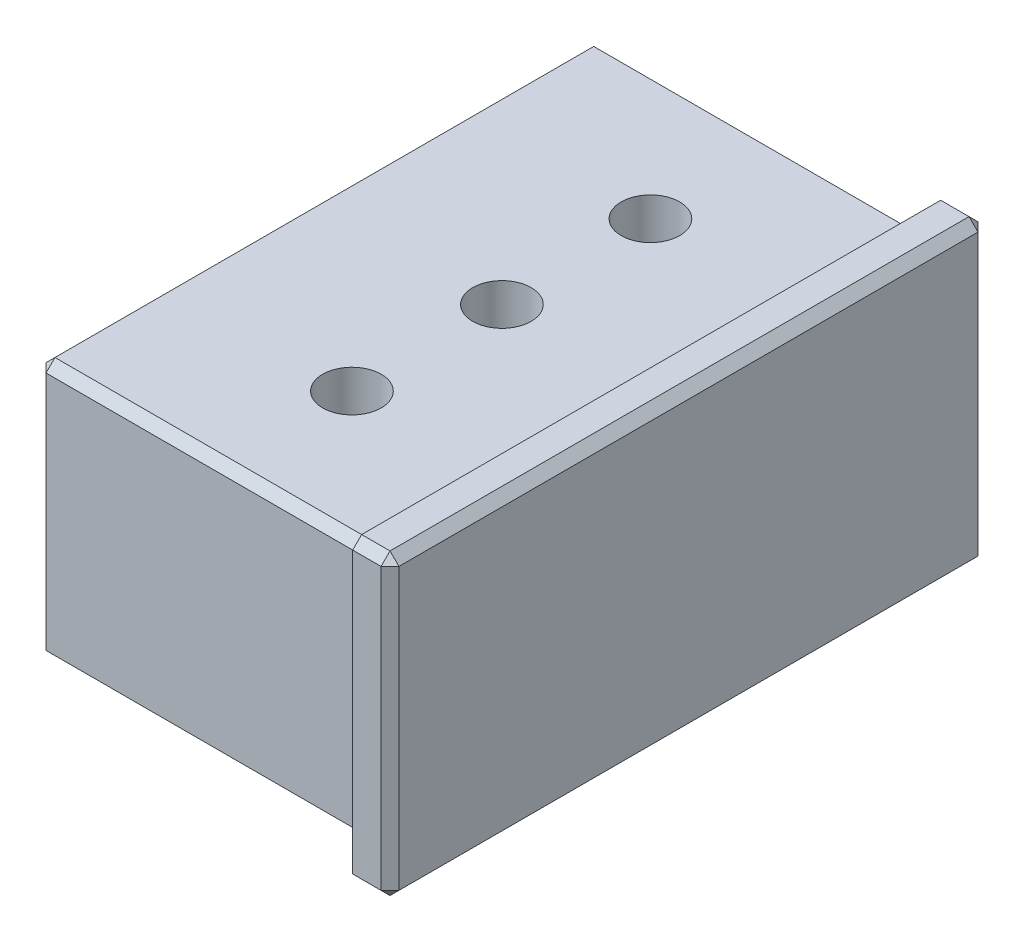
from build123d import *

# Parameters (mm, degrees)
SKETCH1_W           = 47.371
SKETCH1_H           = 21.971
BOSS_EXTRUDE1_DEPTH = 28.575
SKETCH2_W           = 50.8
SKETCH2_H           = 25.4
BOSS_EXTRUDE2_DEPTH = 3.175
CHAMFER1_SIZE       = 0.762
SKETCH3_R           = 2.4892
CUT_EXTRUDE1_DEPTH  = 64.074969049


with BuildPart() as part:
    # Sketch1 → Boss-Extrude1 (new body)
    with BuildSketch(Plane(origin=(0, 0, 0), x_dir=(0, 0, -1), z_dir=(1, 0, 0))):
        with Locations((23.6855, 10.9855)):
            Rectangle(SKETCH1_W, SKETCH1_H)
    extrude(amount=BOSS_EXTRUDE1_DEPTH)

    # Sketch2 → Boss-Extrude2 (add)
    with BuildSketch(Plane(origin=(28.575, 0, 0), x_dir=(0, 0, -1), z_dir=(1, 0, 0))):
        with Locations((23.6855, 10.9855)):
            Rectangle(SKETCH2_W, SKETCH2_H)
    extrude(amount=BOSS_EXTRUDE2_DEPTH)

    # Chamfer1
    chamfer1_edges = [part.edges().sort_by_distance(p)[0] for p in [
        (30.1625, 23.6855, 1.7145),
        (30.1625, -1.7145, 1.7145),
        (30.1625, -1.7145, -49.0855),
        (30.1625, 23.6855, -49.0855),
        (31.75, 10.9855, 1.7145),
        (31.75, -1.7145, -23.6855),
        (31.75, 10.9855, -49.0855),
        (31.75, 23.6855, -23.6855),
        (0, 21.971, -23.6855),
        (0, 10.9855, -47.371),
        (0, 0, -23.6855),
        (0, 10.9855, 0),
        (14.2875, 21.971, 0),
        (14.2875, 21.971, -47.371),
        (14.2875, 0, -47.371),
        (14.2875, 0, 0),
    ]]
    chamfer(chamfer1_edges, length=CHAMFER1_SIZE)

    # Sketch3 → Cut-Extrude1 (cut, through all)
    with BuildSketch(Plane(origin=(0, 21.971, 0), x_dir=(1, 0, 0), z_dir=(0, 1, 0))):
        with Locations(Location((15.875, 23.6855, 0), (0, 0, 270))):
            Circle(SKETCH3_R)
        with Locations(Location((15.875, 36.322, 0), (0, 0, 270))):
            Circle(SKETCH3_R)
        with Locations(Location((15.875, 10.922, 0), (0, 0, 270))):
            Circle(SKETCH3_R)
    extrude(amount=-CUT_EXTRUDE1_DEPTH, mode=Mode.SUBTRACT)


solid = part.part
